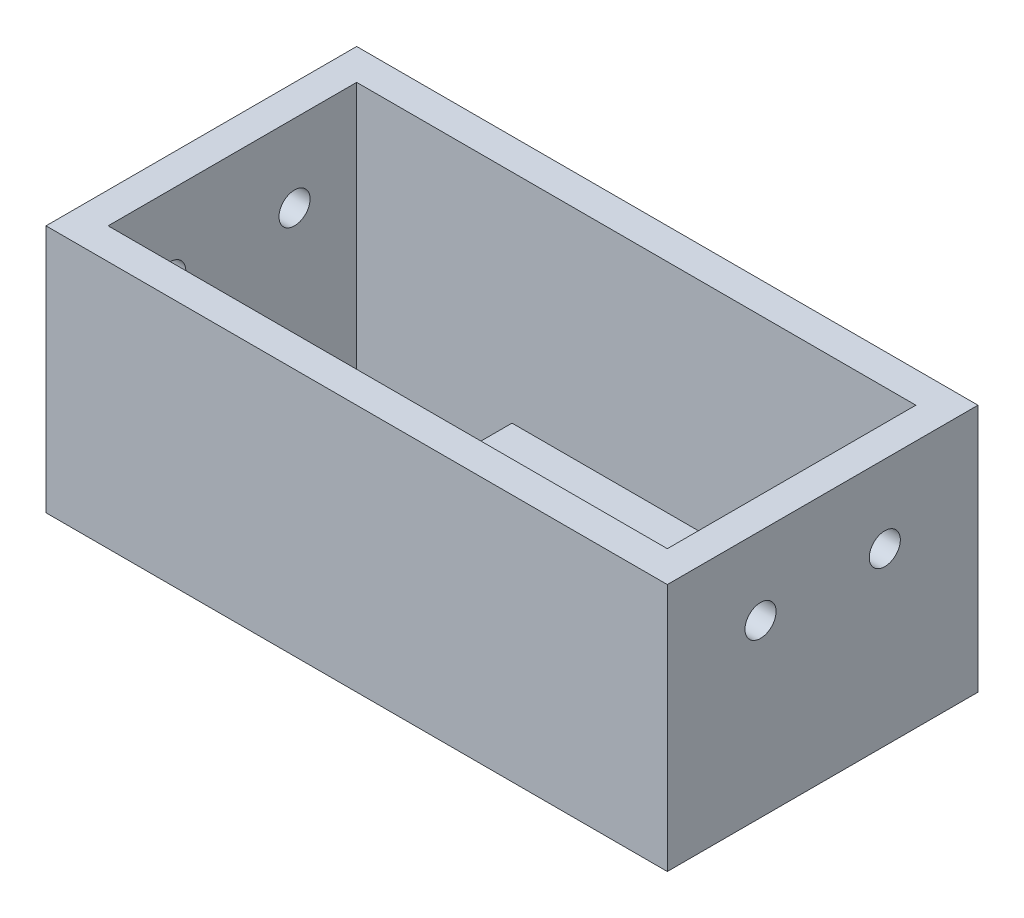
from build123d import *

# Parameters (mm, degrees)
SKETCH1_W           = 100
SKETCH1_H           = 50
SKETCH1_W_2         = 90
SKETCH1_H_2         = 40
BOSS_EXTRUDE1_DEPTH = 40
SKETCH3_W           = 40
SKETCH3_H           = 40
BOSS_EXTRUDE2_DEPTH = 5
SKETCH4_R           = 2.5
CUT_EXTRUDE1_DEPTH  = 116


with BuildPart() as part:
    # Sketch1 → Boss-Extrude1 (new body)
    with BuildSketch(Plane(origin=(0, 0, 0), x_dir=(1, 0, 0), z_dir=(0, 1, 0))):
        with Locations((11.771561772, 25)):
            Rectangle(SKETCH1_W, SKETCH1_H)
        with Locations((11.771561772, 25)):
            Rectangle(SKETCH1_W_2, SKETCH1_H_2, mode=Mode.SUBTRACT)
    extrude(amount=BOSS_EXTRUDE1_DEPTH)

    # Sketch3 → Boss-Extrude2 (add)
    with BuildSketch(Plane(origin=(0, 0, 0), x_dir=(-1, 0, 0), z_dir=(0, -1, 0))):
        with Locations((-11.771561772, 25)):
            Rectangle(SKETCH3_W, SKETCH3_H)
    extrude(amount=-BOSS_EXTRUDE2_DEPTH)

    # Sketch4 → Cut-Extrude1 (cut)
    with BuildSketch(Plane.ZY.offset(38.228438228)):
        with Locations((-35, 27.5)):
            Circle(SKETCH4_R)
        with Locations((-15, 27.5)):
            Circle(SKETCH4_R)
    extrude(amount=-CUT_EXTRUDE1_DEPTH, mode=Mode.SUBTRACT)


solid = part.part
